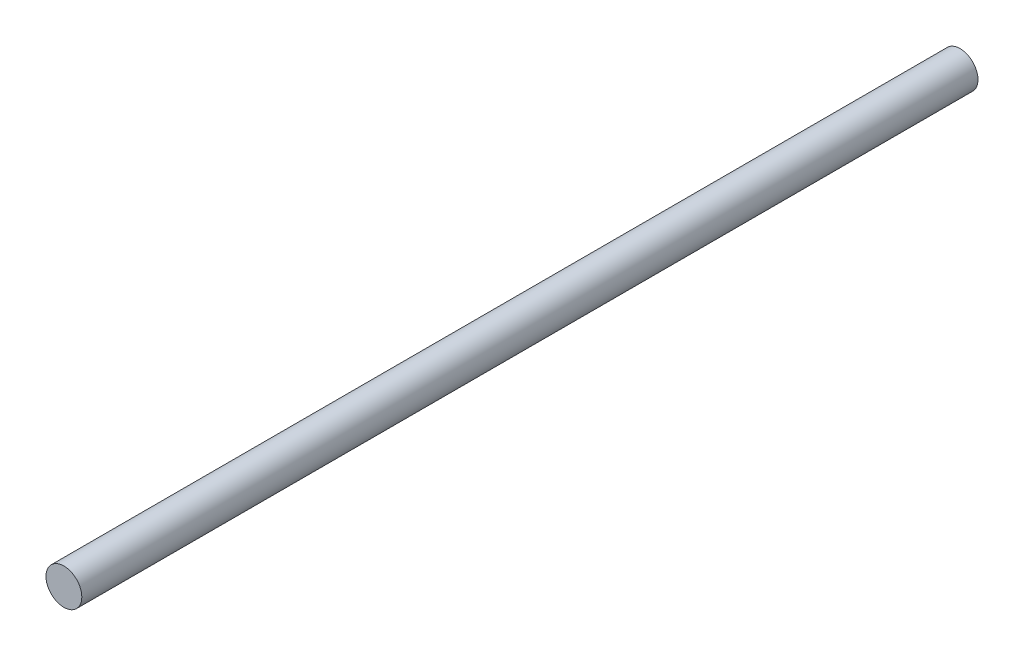
from build123d import *

# Parameters (mm, degrees)
SKETCH_1_R      = 6
EXTRUDE_1_DEPTH = 300


with BuildPart() as part:
    # 草图1 → 凸台-拉伸1 (new body)
    with BuildSketch(Plane.XY):
        Circle(SKETCH_1_R)
    extrude(amount=EXTRUDE_1_DEPTH)


solid = part.part
